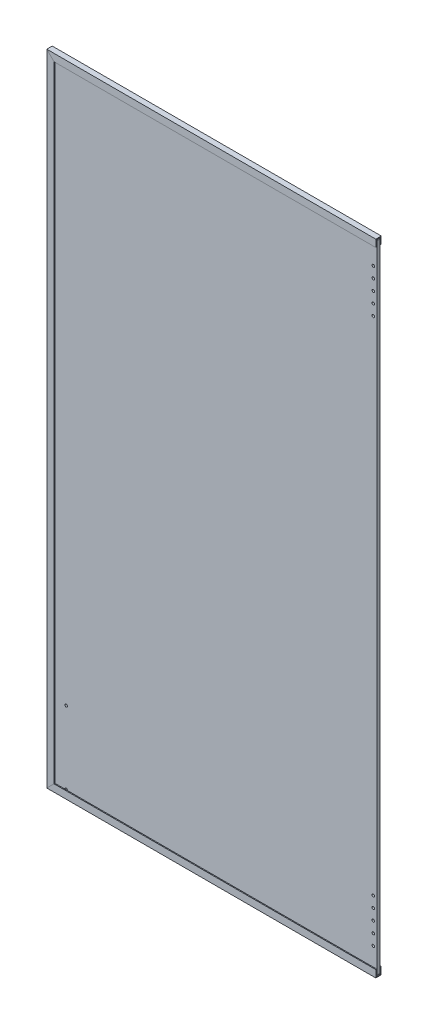
from build123d import *

# Parameters (mm, degrees)
SKETCH2_W                             = 574.675
SKETCH2_H                             = 1117.6
FRAME_OUTER_DIMENSIONS_DEPTH          = 4.7625
SKETCH3_W                             = 561.975
SKETCH3_H                             = 1092.2
FRAME_INNER_DIMENSIONS_DEPTH          = 1247.91834461
FRAME_PROFILE_DEPTH                   = 3.175
FRAME_PROFILE_DEPTH_BACK              = 3.175
SKETCH4_W                             = 573.0875
SKETCH4_H                             = 1114.425
FRAME_SECTION_SPLIT_SURFACE_1_1_BACK  = 1257.731
FRAME_SECTION_SPLIT_SURFACE_1_1_DEPTH = 2515.462
FRAME_SECTION_SPLIT_SURFACE_1_2_BACK  = 1257.731
FRAME_SECTION_SPLIT_SURFACE_1_2_DEPTH = 2515.462
FRAME_SECTION_SPLIT_SURFACE_2_3_BACK  = 1257.731
FRAME_SECTION_SPLIT_SURFACE_2_3_DEPTH = 2515.462
FRAME_SECTION_SPLIT_SURFACE_2_4_BACK  = 1257.731
FRAME_SECTION_SPLIT_SURFACE_2_4_DEPTH = 2515.462
SKETCH5_W                             = 571.5
SKETCH5_H                             = 1111.25
DOOR_PANEL_DEPTH                      = 2.794
SKETCH9_W                             = 2.2479
SKETCH9_H                             = 7.5565
F_8_CLEARANCE_HOLE1_AT_2_COUNT        = 2
F_8_CLEARANCE_HOLE1_AT_2_PITCH        = 19.05
F_8_CLEARANCE_HOLE1_AT_3_COUNT        = 2
F_8_CLEARANCE_HOLE1_AT_3_PITCH        = 38.1
F_8_CLEARANCE_HOLE1_AT_4_COUNT        = 2
F_8_CLEARANCE_HOLE1_AT_4_PITCH        = 57.15
F_8_CLEARANCE_HOLE1_AT_5_COUNT        = 2
F_8_CLEARANCE_HOLE1_AT_5_PITCH        = 76.2
F_8_CLEARANCE_HOLE1_AT_6_COUNT        = 2
F_8_CLEARANCE_HOLE1_AT_6_PITCH        = 971.55
F_8_CLEARANCE_HOLE1_AT_7_COUNT        = 2
F_8_CLEARANCE_HOLE1_AT_7_PITCH        = 990.6
F_8_CLEARANCE_HOLE1_AT_8_COUNT        = 2
F_8_CLEARANCE_HOLE1_AT_8_PITCH        = 1009.65
F_8_CLEARANCE_HOLE1_AT_9_COUNT        = 2
F_8_CLEARANCE_HOLE1_AT_9_PITCH        = 1028.7
F_8_CLEARANCE_HOLE1_AT_10_COUNT       = 2
F_8_CLEARANCE_HOLE1_AT_10_PITCH       = 952.5
SKETCH12_W                            = 2.2479
SKETCH12_H                            = 7.5565
F_8_CLEARANCE_HOLE2_AT_2_COUNT        = 2
F_8_CLEARANCE_HOLE2_AT_2_PITCH        = 127


with BuildPart() as part:
    # Sketch2 → Frame outer dimensions (new, symmetric)
    with BuildSketch(Plane.XY):
        with Locations((290.5125, 546.1)):
            Rectangle(SKETCH2_W, SKETCH2_H)
    extrude(amount=FRAME_OUTER_DIMENSIONS_DEPTH, both=True)

    # Sketch3 → Frame inner dimensions (cut, through all)
    with BuildSketch(Plane.XY.offset(4.7625)):
        with Locations((296.8625, 546.1)):
            Rectangle(SKETCH3_W, SKETCH3_H)
    extrude(amount=-FRAME_INNER_DIMENSIONS_DEPTH, mode=Mode.SUBTRACT)

    # Sketch4 → Frame profile (cut, two sides: drawn at the far end of the back side and taken through both)
    with BuildSketch(Plane.XY.offset(-FRAME_PROFILE_DEPTH_BACK)):
        with Locations((291.30625, 546.1)):
            Rectangle(SKETCH4_W, SKETCH4_H)
    extrude(amount=FRAME_PROFILE_DEPTH + FRAME_PROFILE_DEPTH_BACK, mode=Mode.SUBTRACT)


with BuildPart() as body_2:
    # Frame section split: the piece behind the surface
    add(part.part)
    # Frame section split surface 1: a surface, the sketch's curves swept straight by 2515.462 mm
    with BuildLine(Plane.XY.offset(4.7625).offset(-FRAME_SECTION_SPLIT_SURFACE_1_1_BACK), mode=Mode.PRIVATE) as frame_section_split_surface_1_1_path:
        Line((3.175, 1104.9), (15.875, 1092.2))
    frame_section_split_surface_1_1 = Shell.extrude(frame_section_split_surface_1_1_path.wire(), (0 * FRAME_SECTION_SPLIT_SURFACE_1_1_DEPTH, 0 * FRAME_SECTION_SPLIT_SURFACE_1_1_DEPTH, 1 * FRAME_SECTION_SPLIT_SURFACE_1_1_DEPTH))
    split(bisect_by=frame_section_split_surface_1_1, keep=Keep.BOTTOM)


with BuildPart() as part_1:
    add(part.part)

    # Frame section split: split by a surface, the side it looks to stays
    # Frame section split surface 1: a surface, the sketch's curves swept straight by 2515.462 mm
    with BuildLine(Plane.XY.offset(4.7625).offset(-FRAME_SECTION_SPLIT_SURFACE_1_2_BACK), mode=Mode.PRIVATE) as frame_section_split_surface_1_2_path:
        Line((3.175, 1104.9), (15.875, 1092.2))
    frame_section_split_surface_1_2 = Shell.extrude(frame_section_split_surface_1_2_path.wire(), (0 * FRAME_SECTION_SPLIT_SURFACE_1_2_DEPTH, 0 * FRAME_SECTION_SPLIT_SURFACE_1_2_DEPTH, 1 * FRAME_SECTION_SPLIT_SURFACE_1_2_DEPTH))
    split(bisect_by=frame_section_split_surface_1_2, keep=Keep.TOP)


with BuildPart() as body_3:
    # Frame section split 2 body 2: the piece behind the surface
    add(body_2.part)
    # Frame section split surface 2: a surface, the sketch's curves swept straight by 2515.462 mm
    with BuildLine(Plane.XY.offset(4.7625).offset(-FRAME_SECTION_SPLIT_SURFACE_2_3_BACK), mode=Mode.PRIVATE) as frame_section_split_surface_2_3_path:
        Line((3.175, -12.7), (15.875, 0))
    frame_section_split_surface_2_3 = Shell.extrude(frame_section_split_surface_2_3_path.wire(), (0 * FRAME_SECTION_SPLIT_SURFACE_2_3_DEPTH, 0 * FRAME_SECTION_SPLIT_SURFACE_2_3_DEPTH, 1 * FRAME_SECTION_SPLIT_SURFACE_2_3_DEPTH))
    split(bisect_by=frame_section_split_surface_2_3, keep=Keep.BOTTOM)


with BuildPart() as body_2_1:
    add(body_2.part)

    # Frame section split 2 body 2: split by a surface, the side it looks to stays
    # Frame section split surface 2: a surface, the sketch's curves swept straight by 2515.462 mm
    with BuildLine(Plane.XY.offset(4.7625).offset(-FRAME_SECTION_SPLIT_SURFACE_2_4_BACK), mode=Mode.PRIVATE) as frame_section_split_surface_2_4_path:
        Line((3.175, -12.7), (15.875, 0))
    frame_section_split_surface_2_4 = Shell.extrude(frame_section_split_surface_2_4_path.wire(), (0 * FRAME_SECTION_SPLIT_SURFACE_2_4_DEPTH, 0 * FRAME_SECTION_SPLIT_SURFACE_2_4_DEPTH, 1 * FRAME_SECTION_SPLIT_SURFACE_2_4_DEPTH))
    split(bisect_by=frame_section_split_surface_2_4, keep=Keep.TOP)


with BuildPart() as body_4:
    # Sketch5 → Door panel (new, symmetric)
    with BuildSketch(Plane.XY):
        with Locations((292.1, 546.1)):
            Rectangle(SKETCH5_W, SKETCH5_H)
    extrude(amount=DOOR_PANEL_DEPTH, both=True)

    # Sketch9 → #8 Clearance Hole1 (revolve, cut)
    with BuildSketch(Plane(origin=(571.5, 31.75, 2.794), x_dir=(0, -1, 0), z_dir=(1, 0, 0))):
        with Locations((1.12395, 3.77825)):
            Rectangle(SKETCH9_W, SKETCH9_H)
    f_8_clearance_hole1 = revolve(axis=Axis((571.5, 31.75, 9.144), (0, 0, -1)), mode=Mode.SUBTRACT)

    # #8 Clearance Hole1 at 2: #8 Clearance Hole1 ×2
    with Locations(*[(0, i * F_8_CLEARANCE_HOLE1_AT_2_PITCH, 0) for i in range(1, F_8_CLEARANCE_HOLE1_AT_2_COUNT)]):
        add(f_8_clearance_hole1, mode=Mode.SUBTRACT)

    # #8 Clearance Hole1 at 3: #8 Clearance Hole1 ×2
    with Locations(*[(0, i * F_8_CLEARANCE_HOLE1_AT_3_PITCH, 0) for i in range(1, F_8_CLEARANCE_HOLE1_AT_3_COUNT)]):
        add(f_8_clearance_hole1, mode=Mode.SUBTRACT)

    # #8 Clearance Hole1 at 4: #8 Clearance Hole1 ×2
    with Locations(*[(0, i * F_8_CLEARANCE_HOLE1_AT_4_PITCH, 0) for i in range(1, F_8_CLEARANCE_HOLE1_AT_4_COUNT)]):
        add(f_8_clearance_hole1, mode=Mode.SUBTRACT)

    # #8 Clearance Hole1 at 5: #8 Clearance Hole1 ×2
    with Locations(*[(0, i * F_8_CLEARANCE_HOLE1_AT_5_PITCH, 0) for i in range(1, F_8_CLEARANCE_HOLE1_AT_5_COUNT)]):
        add(f_8_clearance_hole1, mode=Mode.SUBTRACT)

    # #8 Clearance Hole1 at 6: #8 Clearance Hole1 ×2
    with Locations(*[(0, i * F_8_CLEARANCE_HOLE1_AT_6_PITCH, 0) for i in range(1, F_8_CLEARANCE_HOLE1_AT_6_COUNT)]):
        add(f_8_clearance_hole1, mode=Mode.SUBTRACT)

    # #8 Clearance Hole1 at 7: #8 Clearance Hole1 ×2
    with Locations(*[(0, i * F_8_CLEARANCE_HOLE1_AT_7_PITCH, 0) for i in range(1, F_8_CLEARANCE_HOLE1_AT_7_COUNT)]):
        add(f_8_clearance_hole1, mode=Mode.SUBTRACT)

    # #8 Clearance Hole1 at 8: #8 Clearance Hole1 ×2
    with Locations(*[(0, i * F_8_CLEARANCE_HOLE1_AT_8_PITCH, 0) for i in range(1, F_8_CLEARANCE_HOLE1_AT_8_COUNT)]):
        add(f_8_clearance_hole1, mode=Mode.SUBTRACT)

    # #8 Clearance Hole1 at 9: #8 Clearance Hole1 ×2
    with Locations(*[(0, i * F_8_CLEARANCE_HOLE1_AT_9_PITCH, 0) for i in range(1, F_8_CLEARANCE_HOLE1_AT_9_COUNT)]):
        add(f_8_clearance_hole1, mode=Mode.SUBTRACT)

    # #8 Clearance Hole1 at 10: #8 Clearance Hole1 ×2
    with Locations(*[(0, i * F_8_CLEARANCE_HOLE1_AT_10_PITCH, 0) for i in range(1, F_8_CLEARANCE_HOLE1_AT_10_COUNT)]):
        add(f_8_clearance_hole1, mode=Mode.SUBTRACT)

    # Sketch12 → #8 Clearance Hole2 (revolve, cut)
    with BuildSketch(Plane(origin=(34.925, 0, 2.794), x_dir=(0, -1, 0), z_dir=(1, 0, 0))):
        with Locations((1.12395, 3.77825)):
            Rectangle(SKETCH12_W, SKETCH12_H)
    f_8_clearance_hole2 = revolve(axis=Axis((34.925, 0, 9.144), (0, 0, -1)), mode=Mode.SUBTRACT)

    # #8 Clearance Hole2 at 2: #8 Clearance Hole2 ×2
    with Locations(*[(0, i * F_8_CLEARANCE_HOLE2_AT_2_PITCH, 0) for i in range(1, F_8_CLEARANCE_HOLE2_AT_2_COUNT)]):
        add(f_8_clearance_hole2, mode=Mode.SUBTRACT)


with BuildPart() as body_5:
    # Mirror1: mirrored copy
    add(part_1.part.mirror(Plane(origin=(0, 0, 0), x_dir=(0, 0, 1), z_dir=(1, 0, 0))))


with BuildPart() as body_6:
    # Mirror1 2: mirrored copy
    add(body_2_1.part.mirror(Plane(origin=(0, 0, 0), x_dir=(0, 0, 1), z_dir=(1, 0, 0))))


with BuildPart() as body_7:
    # Mirror1 3: mirrored copy
    add(body_3.part.mirror(Plane(origin=(0, 0, 0), x_dir=(0, 0, 1), z_dir=(1, 0, 0))))


with BuildPart() as body_8:
    # Mirror1 4: mirrored copy
    add(body_4.part.mirror(Plane(origin=(0, 0, 0), x_dir=(0, 0, 1), z_dir=(1, 0, 0))))


solid = Compound([part_1.part, body_3.part, body_2_1.part, body_4.part])
